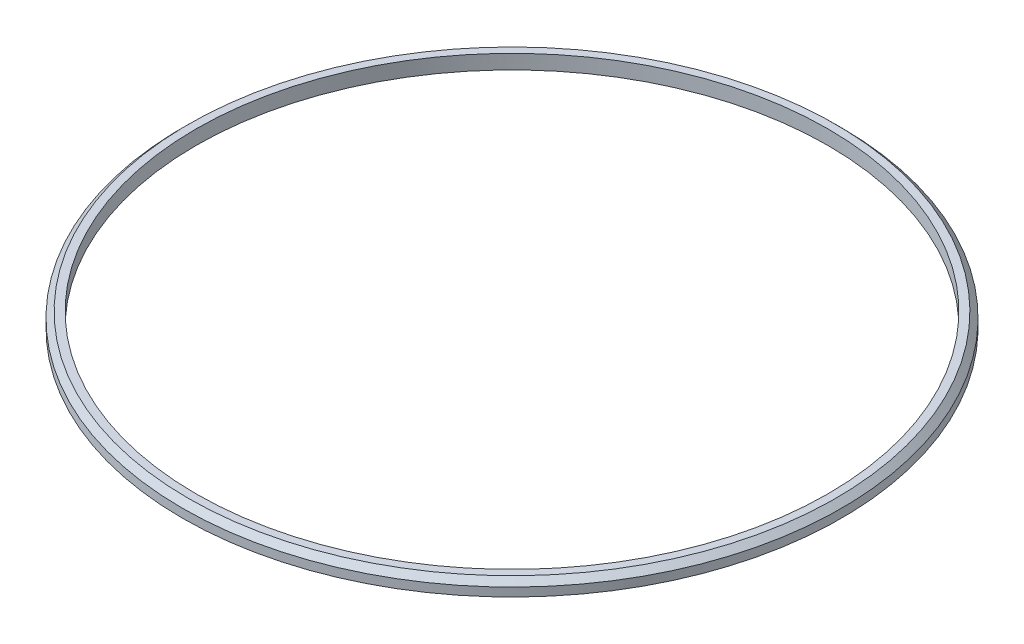
from build123d import *

# Parameters (mm, degrees)
SKETCH1_R           = 57.225
SKETCH1_R_2         = 54.875
BOSS_EXTRUDE1_DEPTH = 2.5
CHAMFER1_SIZE       = 1


with BuildPart() as part:
    # Sketch1 → Boss-Extrude1 (new body)
    with BuildSketch(Plane(origin=(0, 0, 0), x_dir=(1, 0, 0), z_dir=(0, 1, 0))):
        with Locations(Location((0, 0, 0), (0, 0, 270))):
            Circle(SKETCH1_R)
        with Locations(Location((0, 0, 0), (0, 0, 270))):
            Circle(SKETCH1_R_2, mode=Mode.SUBTRACT)
    extrude(amount=BOSS_EXTRUDE1_DEPTH)

    # Chamfer1
    chamfer1_edges = [part.edges().sort_by_distance(p)[0] for p in [
        (0, 2.5, -57.225),
    ]]
    chamfer(chamfer1_edges, length=CHAMFER1_SIZE)


solid = part.part
